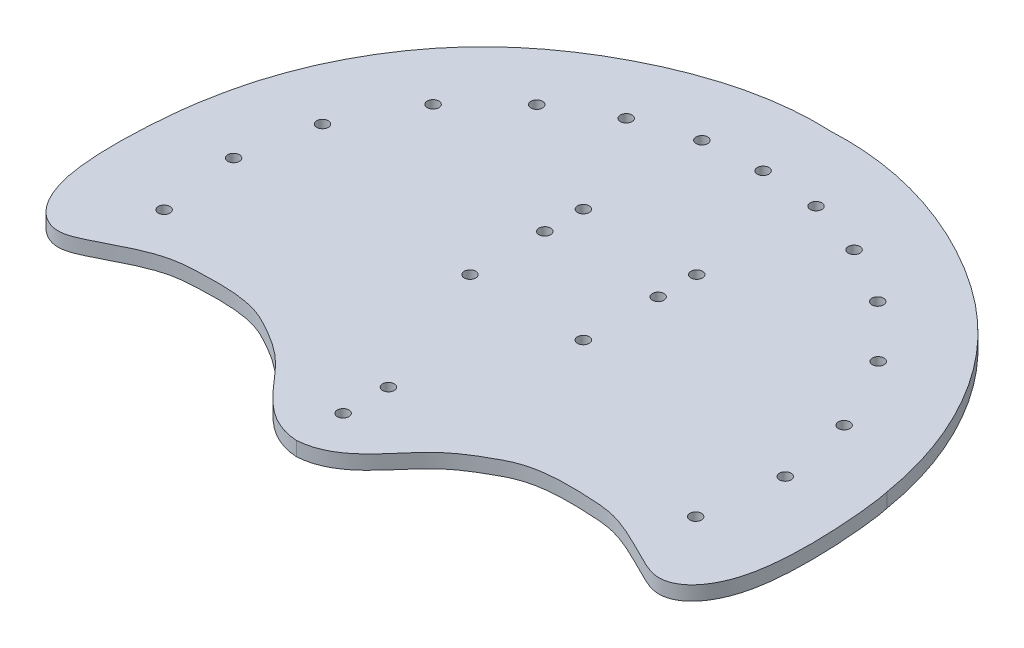
from build123d import *

# Parameters (mm, degrees)
BOSS_EXTRUDE1_DEPTH      = 7.9502
F_0_257_DIAMETER_HOLE2_D = 6.5278


with BuildPart() as part:
    # Sketch3 → Boss-Extrude1 (new body)
    with BuildSketch(Plane(origin=(0, 0, 0), x_dir=(1, 0, 0), z_dir=(0, 1, 0))):
        with BuildLine():
            add(Edge.make_bspline(
                [(-190.5, 0), (-184.392726562, 37.537038237), (-157.261289847, 93.964093485), (-82.387478202, 146.622658841), (-31.311374143, 160.799884185), (0, 159.189909928)],
                knots=[0, 0, 0, 0, 0.424401366, 0.656369581, 1, 1, 1, 1], degree=3))
            add(Edge.make_bspline(
                [(190.5, 0), (184.392726562, 37.537038237), (157.261289847, 93.964093485), (82.387478202, 146.622658841), (31.311374143, 160.799884185), (0, 159.189909928)],
                knots=[0, 0, 0, 0, 0.424401366, 0.656369581, 1, 1, 1, 1], degree=3))
            add(Edge.make_bspline(
                [(190.5, 0), (192.064011793, -4.963501926), (201.967167766, -83.314618311), (174.696602041, -109.289958804), (151.630121659, -100.567984898), (131.410771519, -87.719783961), (96.843567628, -85.375403377), (78.692510144, -86.25882742), (58.833533072, -96.87938247), (37.30593461, -109.935798162), (21.349613946, -139.114767457), (0, -140.530090072)],
                knots=[0, 0, 0, 0, 0.166997052, 0.292320514, 0.319633117, 0.42673531, 0.45891405, 0.609241775, 0.641909704, 0.76680237, 1, 1, 1, 1], degree=3))
            add(Edge.make_bspline(
                [(-190.5, 0), (-192.064011793, -4.963501926), (-201.967167766, -83.314618311), (-174.696602041, -109.289958804), (-151.630121659, -100.567984898), (-131.410771519, -87.719783961), (-96.843567628, -85.375403377), (-78.692510144, -86.25882742), (-58.833533072, -96.87938247), (-37.30593461, -109.935798162), (-21.349613946, -139.114767457), (0, -140.530090072)],
                knots=[0, 0, 0, 0, 0.166997052, 0.292320514, 0.319633117, 0.42673531, 0.45891405, 0.609241775, 0.641909704, 0.76680237, 1, 1, 1, 1], degree=3))
        make_face()
    extrude(amount=BOSS_EXTRUDE1_DEPTH)

    # F (0.257) Diameter Hole2 (through all)
    with Locations(Plane(origin=(0, 0, 0), x_dir=(-1, 0, 0), z_dir=(0, -1, 0))):
        with Locations((31.75, 52.07), (31.75, -11.43), (-31.75, -11.43), (31.75, 30.48), (-31.75, 30.48), (-31.75, 52.07), (-154.550815557, -21.091766218), (-148.92196036, -65.660133902), (-146.146860676, 20.320000002), (-124.716626151, 60.842888284), (-95.539197059, 89.733289755), (148.92196036, -65.660133902), (154.550815557, -21.091766218), (124.716626151, 60.842888284), (95.539197059, 89.733289755), (63.844326407, 108.194176591), (31.975257083, 118.72972232), (0, 121.039578202), (-31.975257083, 118.72972232), (-63.844326407, 108.194176591), (146.146860676, 20.32), (0, -88.9), (0, -114.3)):
            Hole(F_0_257_DIAMETER_HOLE2_D / 2)


solid = part.part
